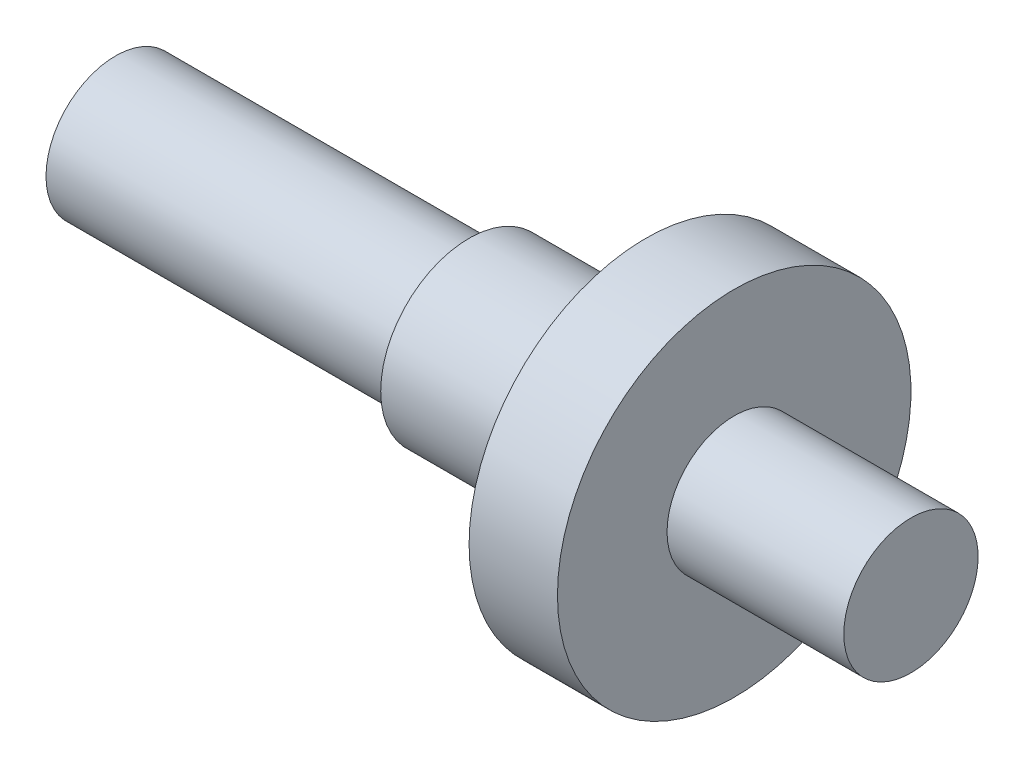
from build123d import *


with BuildPart() as part:
    # Sketch1 → Revolve1 (revolve)
    with BuildSketch(Plane.XY, mode=Mode.PRIVATE) as revolve1_sk:
        Polygon((0, 0), (9.525, 0), (9.525, 2.413), (3.175, 2.413), (3.175, 6.35), (0, 6.35), (0, 3.175), (-6.35, 3.175), (-6.35, 2.5), (-19.05, 2.5), (-19.05, 0), align=None)
    revolve(revolve1_sk.sketch.rotate(Axis((-19.05, 0, 0), (1, 0, 0)), 90), axis=Axis((-19.05, 0, 0), (1, 0, 0)))


solid = part.part
